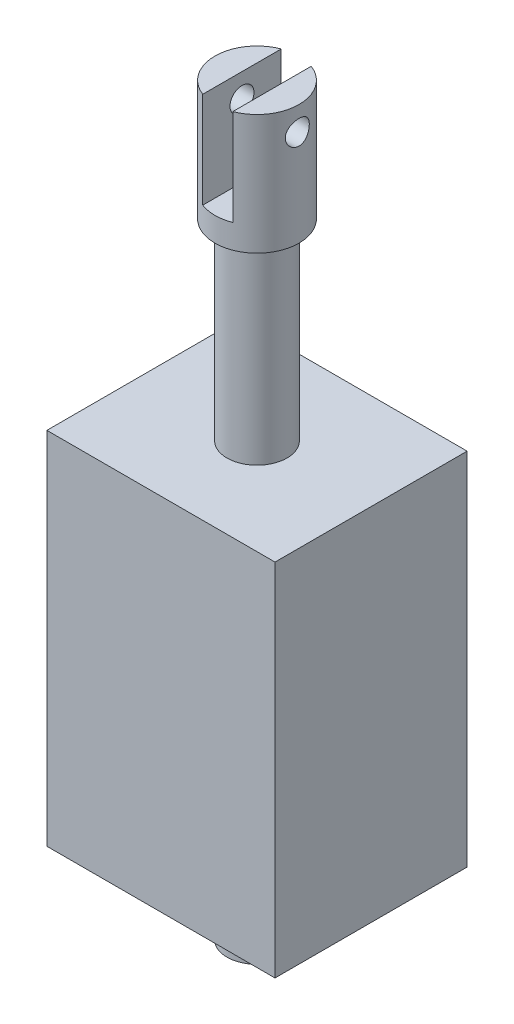
from build123d import *

# Parameters (mm, degrees)
SKETCH1_W               = 19
SKETCH1_H               = 16
BOSS_EXTRUDE1_DEPTH     = 30
SKETCH2_R               = 3.5
BOSS_EXTRUDE2_DEPTH     = 26
SKETCH3_R               = 2.5
BOSS_EXTRUDE3_DEPTH     = 6
SKETCH4_R               = 1
CUT_EXTRUDE2_DEPTH      = 60.674114991
SKETCH5_R               = 3.5
SKETCH5_R_2             = 2.5
CUT_EXTRUDE3_DEPTH      = 16
CUT_EXTRUDE4_DEPTH      = 58.36070093
CUT_EXTRUDE4_DEPTH_BACK = 58.36070093
SKETCH6_W               = 2.5
SKETCH6_H               = 8


with BuildPart() as part:
    # Sketch1 → Boss-Extrude1 (new body)
    with BuildSketch(Plane(origin=(0, 0, 0), x_dir=(1, 0, 0), z_dir=(0, 1, 0))):
        Rectangle(SKETCH1_W, SKETCH1_H)
    extrude(amount=BOSS_EXTRUDE1_DEPTH)

    # Sketch2 → Boss-Extrude2 (add)
    with BuildSketch(Plane(origin=(0, 30, 0), x_dir=(1, 0, 0), z_dir=(0, 1, 0))):
        with Locations(Location((0, 0, 0), (0, 0, 90))):
            Circle(SKETCH2_R)
    extrude(amount=BOSS_EXTRUDE2_DEPTH)

    # Sketch3 → Boss-Extrude3 (add)
    with BuildSketch(Plane.XZ):
        with Locations(Location((0, 0, 0), (0, 0, 270))):
            Circle(SKETCH3_R)
    extrude(amount=BOSS_EXTRUDE3_DEPTH)

    # Sketch4 → Cut-Extrude2 (cut, through all)
    with BuildSketch(Plane(origin=(9.5, 0, 0), x_dir=(0, 0, -1), z_dir=(1, 0, 0))):
        with Locations((0, 54)):
            Circle(SKETCH4_R)
    extrude(amount=-CUT_EXTRUDE2_DEPTH, mode=Mode.SUBTRACT)

    # Sketch5 → Cut-Extrude3 (cut)
    with BuildSketch(Plane(origin=(0, 30, 0), x_dir=(1, 0, 0), z_dir=(0, 1, 0))):
        with Locations(Location((0, 0, 0), (0, 0, 270))):
            Circle(SKETCH5_R)
        with Locations(Location((0, 0, 0), (0, 0, 90))):
            Circle(SKETCH5_R_2, mode=Mode.SUBTRACT)
    extrude(amount=CUT_EXTRUDE3_DEPTH, mode=Mode.SUBTRACT)

    # Sketch6 → Cut-Extrude4 (cut, two sides: drawn at the far end of the back side and taken through both)
    with BuildSketch(Plane.XY.offset(-CUT_EXTRUDE4_DEPTH_BACK)):
        with Locations((0, 52)):
            Rectangle(SKETCH6_W, SKETCH6_H)
    extrude(amount=CUT_EXTRUDE4_DEPTH + CUT_EXTRUDE4_DEPTH_BACK, mode=Mode.SUBTRACT)


solid = part.part
